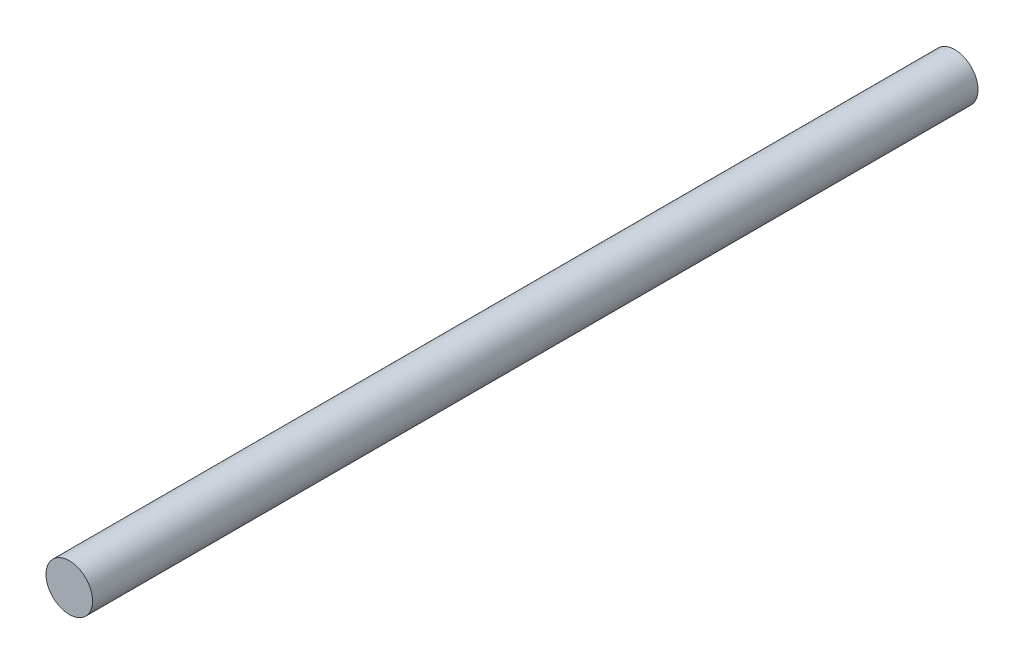
from build123d import *

# Parameters (mm, degrees)
SKETCH1_R           = 6.35
BOSS_EXTRUDE1_DEPTH = 241.3


with BuildPart() as part:
    # Sketch1 → Boss-Extrude1 (new body)
    with BuildSketch(Plane.XY):
        with Locations(Location((0, 0, 0), (0, 0, 180))):
            Circle(SKETCH1_R)
    extrude(amount=BOSS_EXTRUDE1_DEPTH)


solid = part.part
